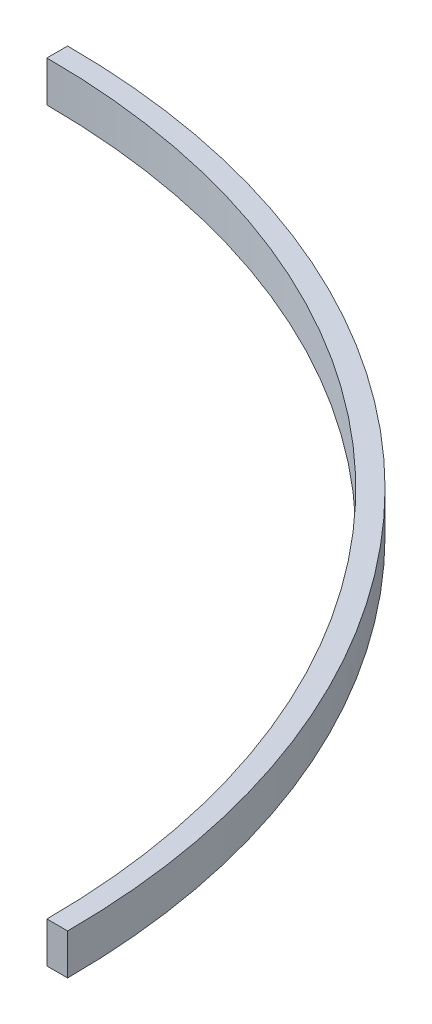
from build123d import *

# Parameters (mm, degrees)
BOSS_EXTRUDE1_DEPTH = 25


with BuildPart() as part:
    # Sketch1 → Boss-Extrude1 (new body)
    with BuildSketch(Plane(origin=(0, 0, 0), x_dir=(1, 0, 0), z_dir=(0, 1, 0))):
        with BuildLine():
            Line((0, 470), (0, 457.3))
            ThreePointArc((0, 457.3), (323.359931037, 323.359931037), (457.3, 0))
            Line((457.3, 0), (470, 0))
            ThreePointArc((470, 0), (332.340187158, 332.340187158), (0, 470))
        make_face()
    extrude(amount=BOSS_EXTRUDE1_DEPTH)


solid = part.part
